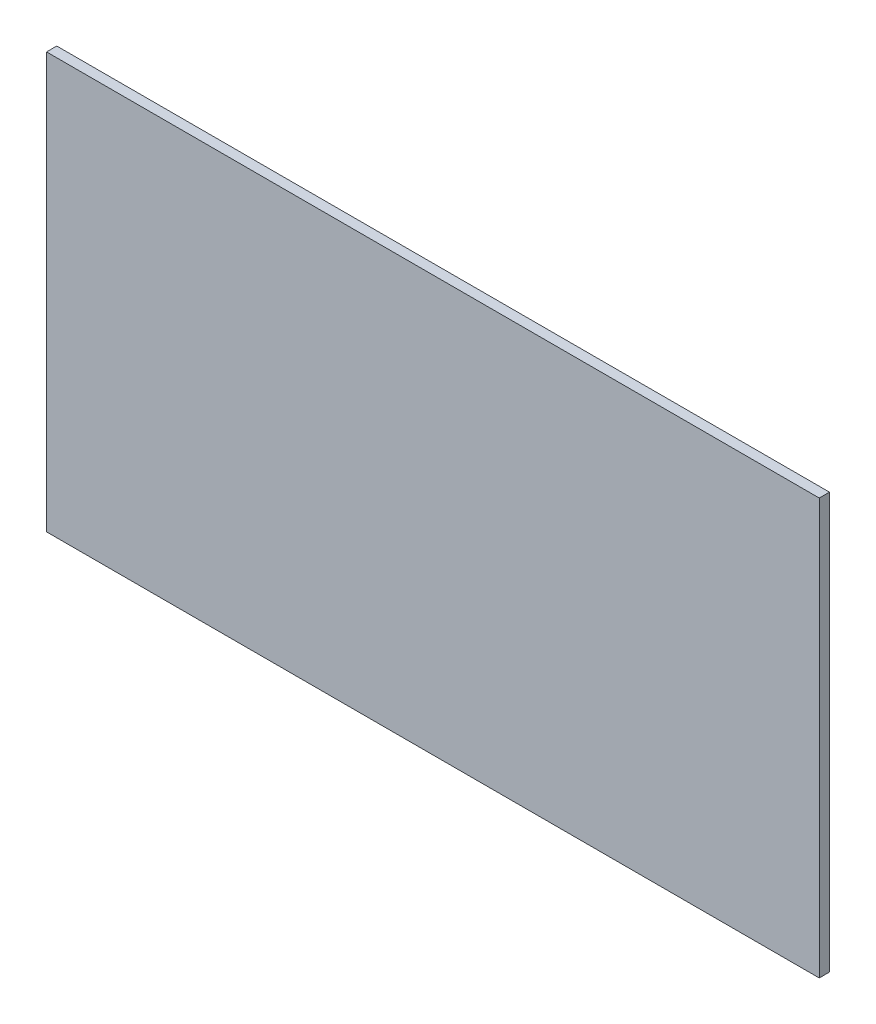
from build123d import *

# Parameters (mm, degrees)
ESQUISSE1_W        = 303
ESQUISSE1_H        = 163
BOSS_EXTRU_1_DEPTH = 4


with BuildPart() as part:
    # Esquisse1 → Boss.-Extru.1 (new body)
    with BuildSketch(Plane.XY):
        Rectangle(ESQUISSE1_W, ESQUISSE1_H)
    extrude(amount=BOSS_EXTRU_1_DEPTH)


solid = part.part
